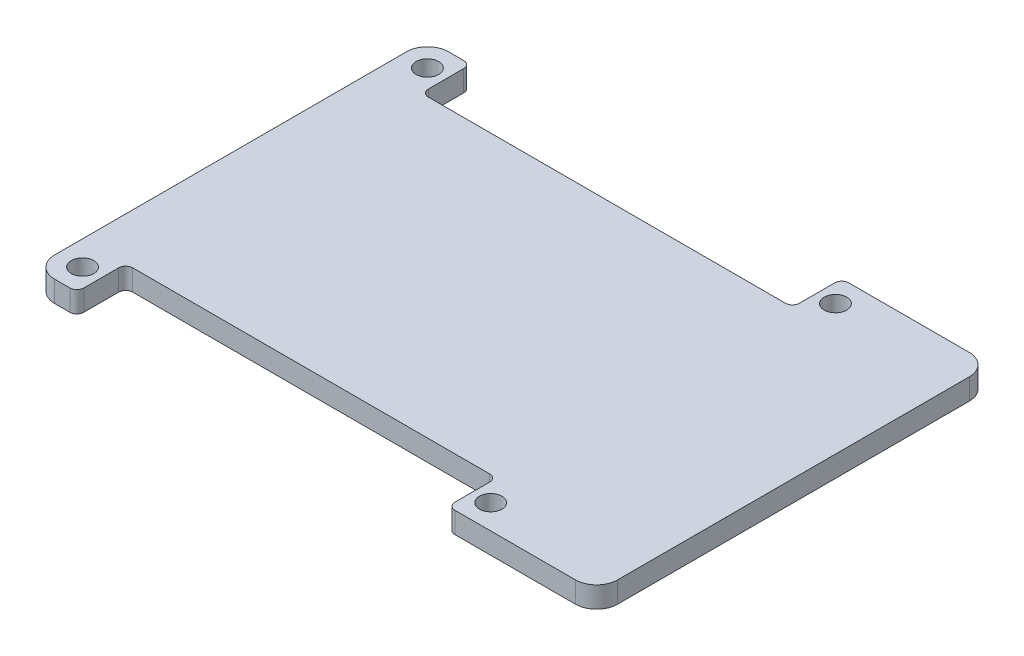
from build123d import *

# Parameters (mm, degrees)
SKETCH_1_R      = 1.6
EXTRUDE_1_DEPTH = 3


with BuildPart() as part:
    # 草图1 → 凸台-拉伸1 (new body)
    with BuildSketch(Plane(origin=(0, 0, 0), x_dir=(1, 0, 0), z_dir=(0, 1, 0))):
        with BuildLine():
            Line((-21.134628196, 23.389975432), (-21.134628196, 18.377736005))
            ThreePointArc((-21.134628196, 18.377736005), (-21.427521415, 17.670629223), (-22.134628196, 17.377736005))
            Line((-22.134628196, 17.377736005), (-72.874730915, 17.377736005))
            ThreePointArc((-72.874730915, 17.377736005), (-73.581837696, 17.670629223), (-73.874730915, 18.377736005))
            Line((-73.874730915, 18.377736005), (-73.874730915, 23.389975432))
            ThreePointArc((-73.874730915, 23.389975432), (-74.167624134, 24.097082213), (-74.874730915, 24.389975432))
            Line((-74.874730915, 24.389975432), (-77.021723127, 24.389975432))
            ThreePointArc((-77.021723127, 24.389975432), (-79.134066788, 23.515014039), (-80.009028181, 21.402670377))
            Line((-80.009028181, 21.402670377), (-80.009028181, -28.604431477))
            ThreePointArc((-80.009028181, -28.604431477), (-79.134066788, -30.716775138), (-77.021723127, -31.591736531))
            Line((-77.021723127, -31.591736531), (-74.874730915, -31.591736531))
            ThreePointArc((-74.874730915, -31.591736531), (-74.167624134, -31.298843313), (-73.874730915, -30.591736531))
            Line((-73.874730915, -30.591736531), (-73.874730915, -25.64502865))
            ThreePointArc((-73.874730915, -25.64502865), (-73.581837696, -24.937921869), (-72.874730915, -24.64502865))
            Line((-72.874730915, -24.64502865), (-22.134628196, -24.64502865))
            ThreePointArc((-22.134628196, -24.64502865), (-21.427521415, -24.937921869), (-21.134628196, -25.64502865))
            Line((-21.134628196, -25.64502865), (-21.134628196, -30.591736531))
            ThreePointArc((-21.134628196, -30.591736531), (-20.841734977, -31.298843313), (-20.134628196, -31.591736531))
            Line((-20.134628196, -31.591736531), (-3.009028181, -31.591736531))
            ThreePointArc((-3.009028181, -31.591736531), (-0.887707838, -30.713056875), (-0.009028181, -28.591736531))
            Line((-0.009028181, -28.591736531), (-0.009028181, -21.760486998))
            Line((-0.009028181, -21.760486998), (-0.009028181, 21.389975432))
            ThreePointArc((-0.009028181, 21.389975432), (-0.887707838, 23.511295776), (-3.009028181, 24.389975432))
            Line((-3.009028181, 24.389975432), (-20.134628196, 24.389975432))
            ThreePointArc((-20.134628196, 24.389975432), (-20.841734977, 24.097082213), (-21.134628196, 23.389975432))
        make_face()
        with Locations(Location((-76.52848462, 20.886724226, 0), (0, 0, 270))):
            Circle(SKETCH_1_R, mode=Mode.SUBTRACT)
        with Locations(Location((-18.52858622, 20.886597225, 0), (0, 0, 270))):
            Circle(SKETCH_1_R, mode=Mode.SUBTRACT)
        with Locations(Location((-18.52833222, -28.113656775, 0), (0, 0, 270))):
            Circle(SKETCH_1_R, mode=Mode.SUBTRACT)
        with Locations(Location((-76.52833222, -28.113529775, 0), (0, 0, 270))):
            Circle(SKETCH_1_R, mode=Mode.SUBTRACT)
    extrude(amount=EXTRUDE_1_DEPTH)


solid = part.part
